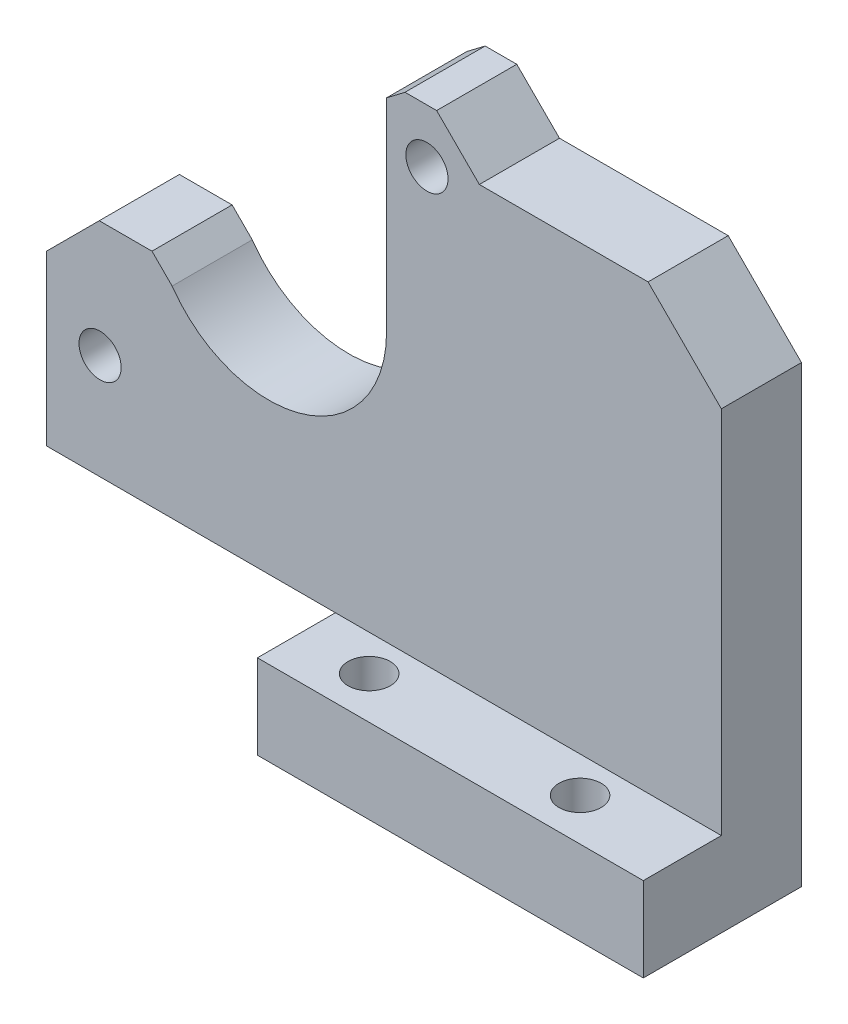
from build123d import *

# Parameters (mm, degrees)
BOSS_EXTRUDE1_DEPTH = 7.6
SKETCH2_W           = 36.6
SKETCH2_H           = 8
BOSS_EXTRUDE2_DEPTH = 7.4
SKETCH3_R           = 2
CUT_EXTRUDE1_DEPTH  = 81.259594442
SKETCH4_R           = 2
CUT_EXTRUDE2_DEPTH  = 80.210873622


with BuildPart() as part:
    # Sketch1 → Boss-Extrude1 (new body)
    with BuildSketch(Plane.XY):
        with BuildLine():
            Line((57.05, 42), (41.05, 42))
            Line((41.05, 42), (37, 46.05))
            Line((37, 46.05), (34, 46.05))
            Line((34, 46.05), (32.25, 44.718087488))
            Line((32.25, 44.718087488), (32.25, 25.468087488))
            ThreePointArc((32.25, 25.468087488), (24.422154993, 14.809809015), (11.91, 19.09))
            Line((11.91, 19.09), (10, 21))
            Line((10, 21), (5, 21))
            Line((5, 21), (0, 16))
            Line((0, 16), (0, 0))
            Line((0, 0), (27.4, 0))
            Line((27.4, 0), (27.4, -8))
            Line((27.4, -8), (64, -8))
            Line((64, -8), (64, 35.05))
            Line((64, 35.05), (57.05, 42))
        make_face()
    extrude(amount=BOSS_EXTRUDE1_DEPTH)

    # Sketch2 → Boss-Extrude2 (add)
    with BuildSketch(Plane.XY.offset(7.6)):
        with Locations((45.7, -4)):
            Rectangle(SKETCH2_W, SKETCH2_H)
    extrude(amount=BOSS_EXTRUDE2_DEPTH)

    # Sketch3 → Cut-Extrude1 (cut, through all)
    with BuildSketch(Plane(origin=(0, 0, 0), x_dir=(1, 0, 0), z_dir=(0, 1, 0))):
        with Locations(Location((54, -11, 0), (0, 0, 270))):
            Circle(SKETCH3_R)
        with Locations(Location((34, -11, 0), (0, 0, 270))):
            Circle(SKETCH3_R)
    extrude(amount=-CUT_EXTRUDE1_DEPTH, mode=Mode.SUBTRACT)

    # Sketch4 → Cut-Extrude2 (cut, through all)
    with BuildSketch(Plane.XY.offset(7.6)):
        with Locations((5.08, 9.968087488)):
            Circle(SKETCH4_R)
        with Locations((36.08, 40.968087488)):
            Circle(SKETCH4_R)
    extrude(amount=-CUT_EXTRUDE2_DEPTH, mode=Mode.SUBTRACT)


solid = part.part
